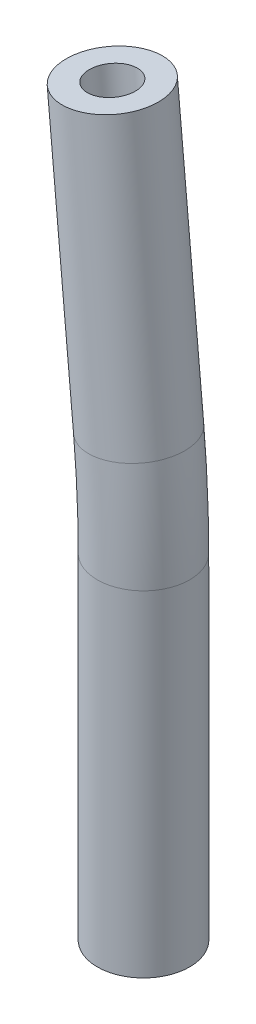
from build123d import *

# Parameters (mm, degrees)
SKETCH2_R   = 2
SKETCH2_R_2 = 1


with BuildPart() as part:
    # Sweep1: sweep along a path in Sketch1
    with BuildLine(Plane.XY) as sweep1_path:
        Line((0.051868138, -16.796867035), (0.051868138, -2.276867035))
        ThreePointArc((0.051868138, -2.276867035), (0, 0), (-0.155496802, 2.272143161))
        Line((-0.155496802, 2.272143161), (-1.298208163, 14.780053088))
    # Sketch2 → Sweep1 (sweep)
    with BuildSketch(Plane(origin=(0, -16.796867035, 0), x_dir=(1, 0, 0), z_dir=(0, 1, 0))):
        with Locations((0.051868138, 0)):
            Circle(SKETCH2_R)
        with Locations((0.051868138, 0)):
            Circle(SKETCH2_R_2, mode=Mode.SUBTRACT)
    sweep(path=sweep1_path.line)


solid = part.part
